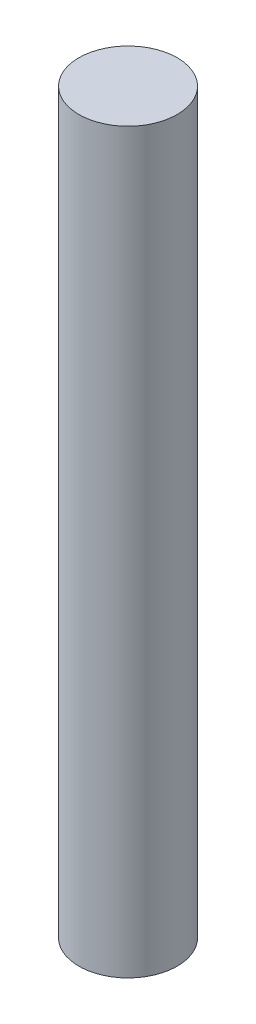
from build123d import *

# Parameters (mm, degrees)
SKETCH1_R           = 1.5
BOSS_EXTRUDE1_DEPTH = 11.25


with BuildPart() as part:
    # Sketch1 → Boss-Extrude1 (new, symmetric)
    with BuildSketch(Plane(origin=(0, 0, 0), x_dir=(1, 0, 0), z_dir=(0, 1, 0))):
        with Locations(Location((0, 0, 0), (0, 0, 90))):
            Circle(SKETCH1_R)
    extrude(amount=BOSS_EXTRUDE1_DEPTH, both=True)


solid = part.part
